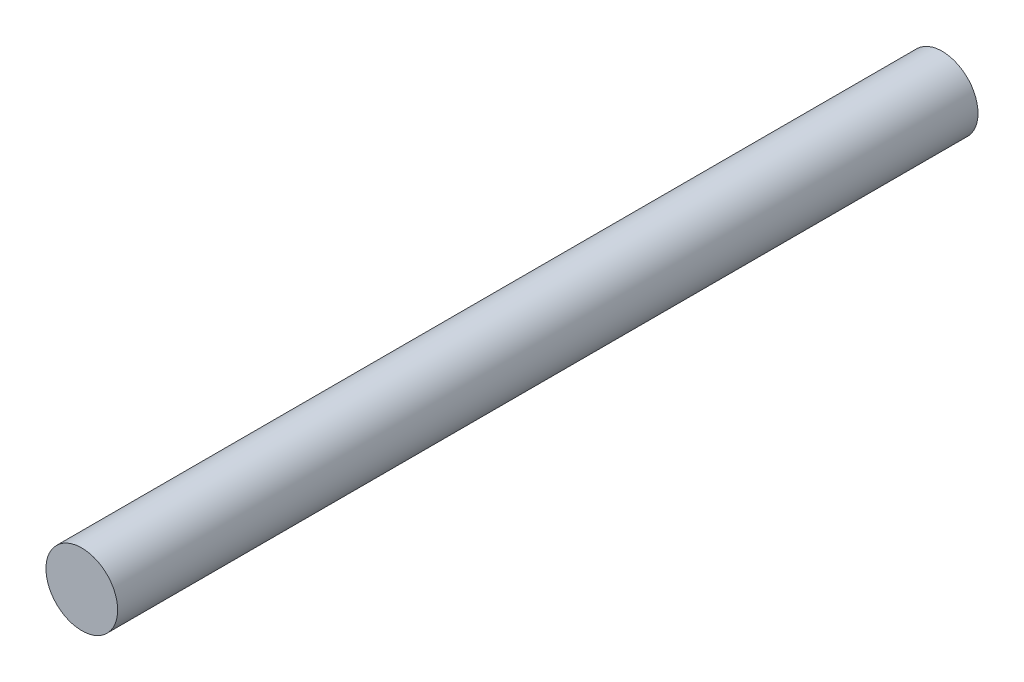
from build123d import *

# Parameters (mm, degrees)
SKETCH1_R      = 6.35
EXTRUDE1_DEPTH = 76.2


with BuildPart() as part:
    # Sketch1 → Extrude1 (new, symmetric)
    with BuildSketch(Plane.XY):
        Circle(SKETCH1_R)
    extrude(amount=EXTRUDE1_DEPTH, both=True)


solid = part.part
